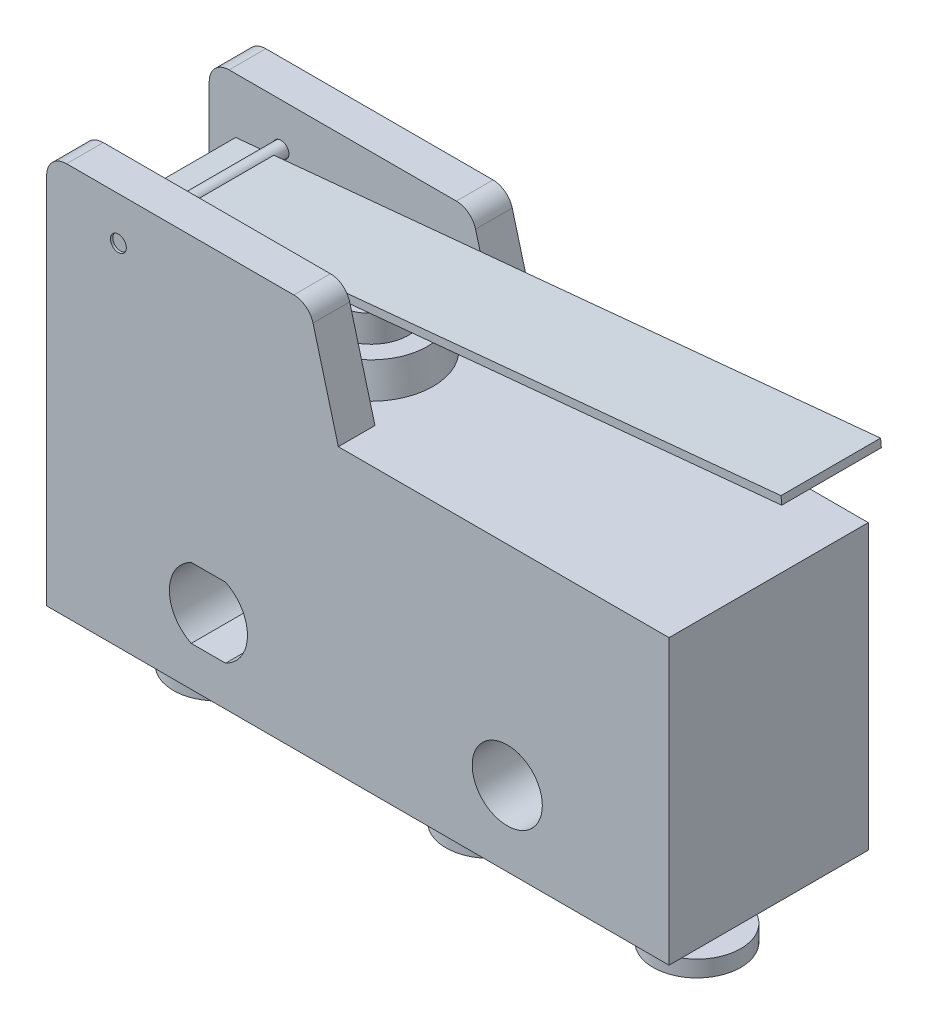
from build123d import *

# Parameters (mm, degrees)
SKETCH1_W             = 19.8374
SKETCH1_H             = 9.0424
SKETCH1_R             = 1.1176
EXTRUDE1_DEPTH        = 3.175
SKETCH5_W             = 20.6502
SKETCH5_H             = 0.254
EXTRUDE2_DEPTH        = 1.5875
SKETCH6_R             = 0.254
EXTRUDE3_DEPTH        = 1.1684
SKETCH7_R             = 0.2413
EXTRUDE4_DEPTH        = 3.1115
LPATTERN1_COUNT       = 2
LPATTERN1_PITCH       = 6.604
LPATTERN2_COUNT       = 2
LPATTERN2_PITCH       = 15.2908
BODY_MOVE_COPY1_ANGLE = 5.5


with BuildPart() as part:
    # Sketch1 → Extrude1 (new, symmetric)
    with BuildSketch(Plane.XY):
        with Locations((0, 4.5212)):
            Rectangle(SKETCH1_W, SKETCH1_H)
        with Locations((4.7625, 2.3876)):
            Circle(SKETCH1_R, mode=Mode.SUBTRACT)
        with BuildLine():
            Line((-5.31022201, 3.5052), (-4.21477799, 3.5052))
            ThreePointArc((-4.21477799, 3.5052), (-3.5179, 2.3876), (-4.21477799, 1.27))
            Line((-4.21477799, 1.27), (-5.31022201, 1.27))
            ThreePointArc((-5.31022201, 1.27), (-6.0071, 2.3876), (-5.31022201, 3.5052))
        make_face(mode=Mode.SUBTRACT)
    extrude(amount=EXTRUDE1_DEPTH, both=True)

    # Sketch3 → Revolve1 (revolve)
    with BuildSketch(Plane.XY, mode=Mode.PRIVATE) as revolve1_sk:
        Polygon((-4.7371, 9.0424), (-4.557951788, 10.0584), (-3.9497, 10.0584), (-3.9497, 9.0424), align=None)
        with BuildLine():
            Line((-3.9243, 9.5504), (-3.9243, 10.8966))
            Line((-3.9243, 10.8966), (-3.61912639, 10.8966))
            ThreePointArc((-3.61912639, 10.8966), (-3.227684061, 11.178114571), (-2.7559, 11.2776))
            Line((-2.7559, 11.2776), (-2.7559, 9.5504))
            Line((-2.7559, 9.5504), (-3.9243, 9.5504))
        make_face()
    revolve(revolve1_sk.sketch.rotate(Axis((-2.7559, 11.2776, 0), (0, 1, 0)), 270), axis=Axis((-2.7559, 11.2776, 0), (0, 1, 0)))


with BuildPart() as revolve1_piece_1:
    # of the separate pieces the step leaves, piece 1, a body of its own (revolve1_pieces)
    add(part.part.solids().sort_by_distance((-9.9187, 0, -3.175))[0])

    # Sketch6 → Extrude3 (add)
    with BuildSketch(Plane.XY.offset(3.175)):
        with BuildLine():
            Line((-9.9187, 9.0424), (-9.9187, 11.8872))
            ThreePointArc((-9.9187, 11.8872), (-9.732712806, 12.336212806), (-9.2837, 12.5222))
            Line((-9.2837, 12.5222), (-2.041962237, 12.5222))
            ThreePointArc((-2.041962237, 12.5222), (-1.65539873, 12.390979371), (-1.428599337, 12.051550094))
            Line((-1.428599337, 12.051550094), (-0.6223, 9.0424))
            Line((-0.6223, 9.0424), (-9.9187, 9.0424))
        make_face()
        with Locations((-7.6327, 11.1506)):
            Circle(SKETCH6_R, mode=Mode.SUBTRACT)
    extrude3 = extrude(amount=-EXTRUDE3_DEPTH)

    # Mirror1: Extrude3 across plane
    add(extrude3.mirror(Plane.XY))

    # Sketch4 → Revolve2 (revolve)
    with BuildSketch(Plane.XY, mode=Mode.PRIVATE) as revolve2_sk:
        with BuildLine():
            Line((6.9977, -0.381), (6.9977, -1.5748))
            Line((6.9977, -1.5748), (6.2357, -1.5748))
            Line((6.2357, -1.5748), (6.2357, -2.095420928))
            Line((6.2357, -2.095420928), (6.6167, -2.3622))
            Line((6.6167, -2.3622), (7.6327, -2.3622))
            Line((7.6327, -2.3622), (7.6327, 0))
            Line((7.6327, 0), (6.6167, 0))
            ThreePointArc((6.6167, 0), (6.886107684, -0.111592316), (6.9977, -0.381))
        make_face()
    revolve2 = revolve(revolve2_sk.sketch.rotate(Axis((7.6327, 0, 0), (0, 1, 0)), 270), axis=Axis((7.6327, 0, 0), (0, 1, 0)))

    # LPattern1: Revolve2 ×2
    with Locations(*[(-i * LPATTERN1_PITCH, 0, 0) for i in range(1, LPATTERN1_COUNT)]):
        add(revolve2)

    # LPattern2: Revolve2 ×2
    with Locations(*[(-i * LPATTERN2_PITCH, 0, 0) for i in range(1, LPATTERN2_COUNT)]):
        add(revolve2)


with BuildPart() as revolve1_piece_2:
    # of the separate pieces the step leaves, piece 2, a body of its own (revolve1_pieces)
    add(part.part.solids().sort_by_distance((-2.7559, 9.5504, -1.1684))[0])


with BuildPart() as body_3:
    # Sketch5 → Extrude2 (new, symmetric)
    with BuildSketch(Plane.XY):
        with Locations((1.6764, 11.1506)):
            Rectangle(SKETCH5_W, SKETCH5_H)
    extrude(amount=EXTRUDE2_DEPTH, both=True)

    # Sketch7 → Extrude4 (add, symmetric)
    with BuildSketch(Plane.XY):
        with Locations((-7.6327, 11.1506)):
            Circle(SKETCH7_R)
    extrude(amount=EXTRUDE4_DEPTH, both=True)


with BuildPart() as body_3_1:
    # Body-Move/Copy1: moved
    add(body_3.part.rotate(Axis((-7.6327, 11.1506, 0), (0, 0, 1)), BODY_MOVE_COPY1_ANGLE))


solid = Compound([revolve1_piece_1.part, revolve1_piece_2.part, body_3_1.part])
